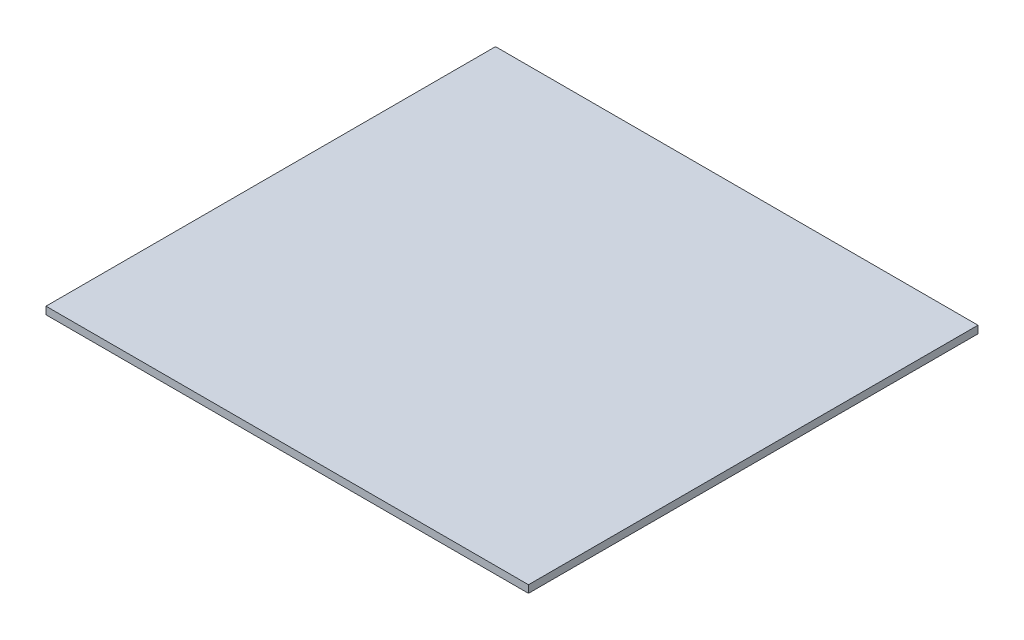
from build123d import *

# Parameters (mm, degrees)
SKETCH_1_W      = 322
SKETCH_1_H      = 300
EXTRUDE_1_DEPTH = 5


with BuildPart() as part:
    # 스케치1 → 보스-돌출1 (new body)
    with BuildSketch(Plane(origin=(0, 0, 0), x_dir=(1, 0, 0), z_dir=(0, 1, 0))):
        with Locations((161, 150)):
            Rectangle(SKETCH_1_W, SKETCH_1_H)
    extrude(amount=EXTRUDE_1_DEPTH)


solid = part.part
